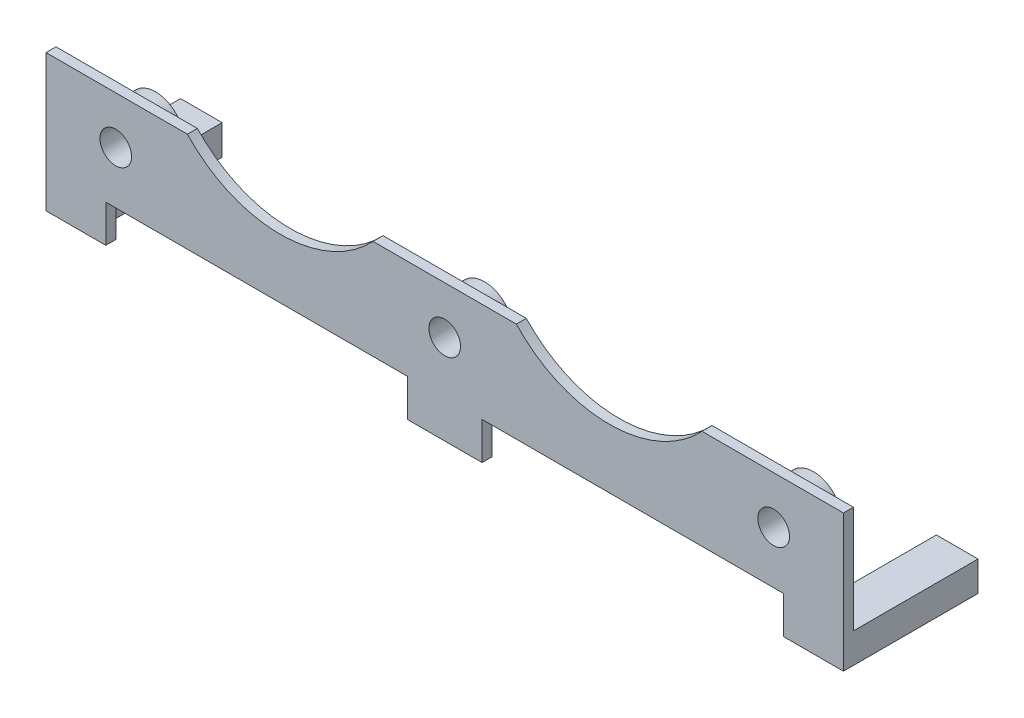
from build123d import *
from build123d.topology import SkipClean

# Parameters (mm, degrees)
CROQUIS1_R              = 3.175
SALIENTE_EXTRUIR1_DEPTH = 2
CROQUIS2_W              = 8.35
CROQUIS2_H              = 6
SALIENTE_EXTRUIR2_DEPTH = 25
CORTAR_EXTRUIR1_DEPTH   = 32.5
SALIENTE_EXTRUIR3_START = 6
CROQUIS4_R              = 5.675
CROQUIS4_R_2            = 3.175
SALIENTE_EXTRUIR3_DEPTH = 6


with BuildPart() as part:
    # Croquis1 → Saliente-Extruir1 (new body)
    with BuildSketch(Plane.XY):
        Polygon((7.5, -22.5), (7.5, -15), (68, -15), (68, -22.5), (80, -22.5), (80, 5), (-80, 5), (-80, -22.5), (-68, -22.5), (-68, -15), (-7.5, -15), (-7.5, -22.5), align=None)
        with Locations((-66, -4.5)):
            Circle(CROQUIS1_R, mode=Mode.SUBTRACT)
        with Locations((66, -4.5)):
            Circle(CROQUIS1_R, mode=Mode.SUBTRACT)
        with Locations((0, -4.5)):
            Circle(CROQUIS1_R, mode=Mode.SUBTRACT)
    extrude(amount=SALIENTE_EXTRUIR1_DEPTH)

    # Croquis2 → Saliente-Extruir2 (add)
    with BuildSketch(Plane(origin=(0, 0, 0), x_dir=(-1, 0, 0), z_dir=(0, 0, -1))):
        with Locations((-75.825, -19.5)):
            Rectangle(CROQUIS2_W, CROQUIS2_H)
        with Locations((75.825, -19.5)):
            Rectangle(CROQUIS2_W, CROQUIS2_H)
    extrude(amount=SALIENTE_EXTRUIR2_DEPTH)

    # Croquis3 → Cortar-Extruir1 (cut)
    with BuildSketch(Plane(origin=(0, 0, 0), x_dir=(-1, 0, 0), z_dir=(0, 0, -1))):
        with BuildLine():
            Line((51.626952658, 5), (14.373047342, 5))
            ThreePointArc((14.373047342, 5), (33, -3.079949918), (51.626952658, 5))
        make_face()
        with BuildLine():
            Line((-14.373047342, 5), (-51.626952658, 5))
            ThreePointArc((-51.626952658, 5), (-33, -3.079949918), (-14.373047342, 5))
        make_face()
    extrude(amount=-CORTAR_EXTRUIR1_DEPTH, mode=Mode.SUBTRACT)

    # Croquis4 → Saliente-Extruir3 (add)
    # profile 1 of 3: a face of its own
    with SkipClean():  # the faces are left unmerged after this step: merging them gives an invalid solid
        with BuildSketch(Plane(origin=(0, 0, 0), x_dir=(-1, 0, 0), z_dir=(0, 0, -1)).offset(SALIENTE_EXTRUIR3_START)):
            with Locations(Location((-66, -4.5, 0), (0, 0, 180))):
                Circle(CROQUIS4_R)
            with Locations((-66, -4.5)):
                Circle(CROQUIS4_R_2, mode=Mode.SUBTRACT)
        # profile 2 of 3: a face of its own
        with BuildSketch(Plane(origin=(0, 0, 0), x_dir=(-1, 0, 0), z_dir=(0, 0, -1)).offset(SALIENTE_EXTRUIR3_START)):
            with Locations(Location((0, -4.5, 0), (0, 0, 180))):
                Circle(CROQUIS4_R)
            with Locations((0, -4.5)):
                Circle(CROQUIS4_R_2, mode=Mode.SUBTRACT)
        # profile 3 of 3: a face of its own
        with BuildSketch(Plane(origin=(0, 0, 0), x_dir=(-1, 0, 0), z_dir=(0, 0, -1)).offset(SALIENTE_EXTRUIR3_START)):
            with Locations(Location((66, -4.5, 0), (0, 0, 180))):
                Circle(CROQUIS4_R)
            with Locations((66, -4.5)):
                Circle(CROQUIS4_R_2, mode=Mode.SUBTRACT)
        extrude(amount=-SALIENTE_EXTRUIR3_DEPTH)


solid = part.part
